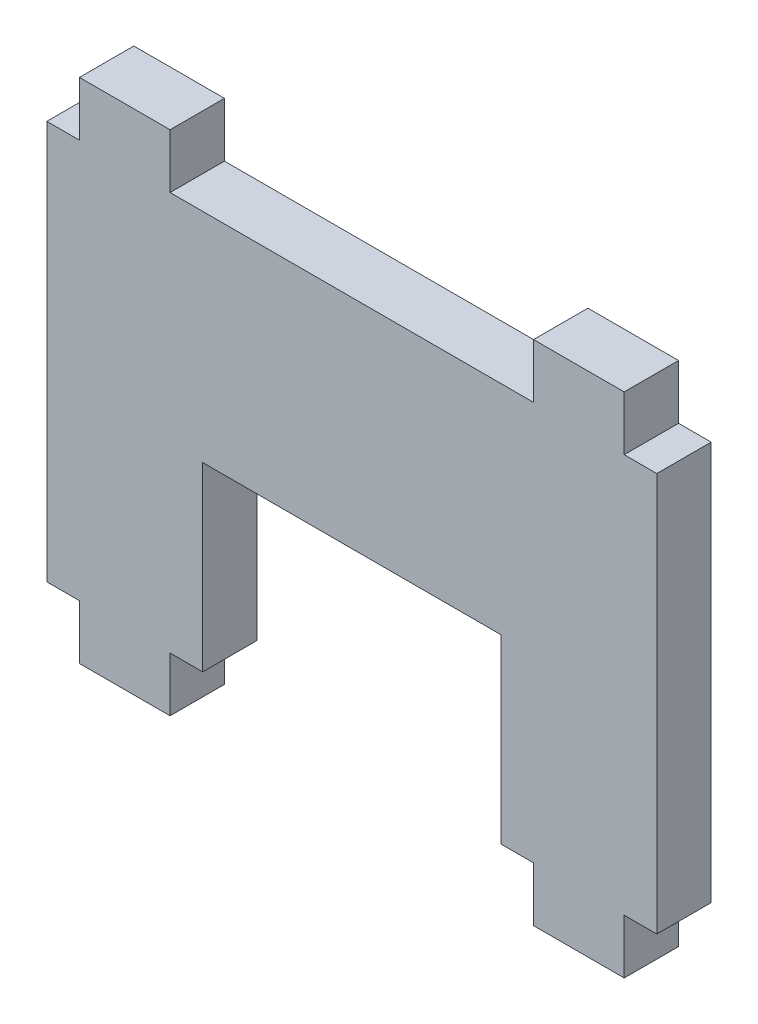
from build123d import *

# Parameters (mm, degrees)
SALIENTE_EXTRUIR1_DEPTH = 3


with BuildPart() as part:
    # Croquis3 → Saliente-Extruir1 (new body)
    with BuildSketch(Plane.XY):
        Polygon((25.05, 0), (26.85, 0), (26.85, -3), (31.85, -3), (31.85, 0), (33.65, 0), (33.65, 22), (31.85, 22), (31.85, 25), (26.85, 25), (26.85, 22), (6.8, 22), (6.8, 25), (1.8, 25), (1.8, 22), (0, 22), (0, 0), (1.8, 0), (1.8, -3), (6.8, -3), (6.8, 0), (8.6, 0), (8.6, 10), (25.05, 10), align=None)
    extrude(amount=SALIENTE_EXTRUIR1_DEPTH)


solid = part.part
